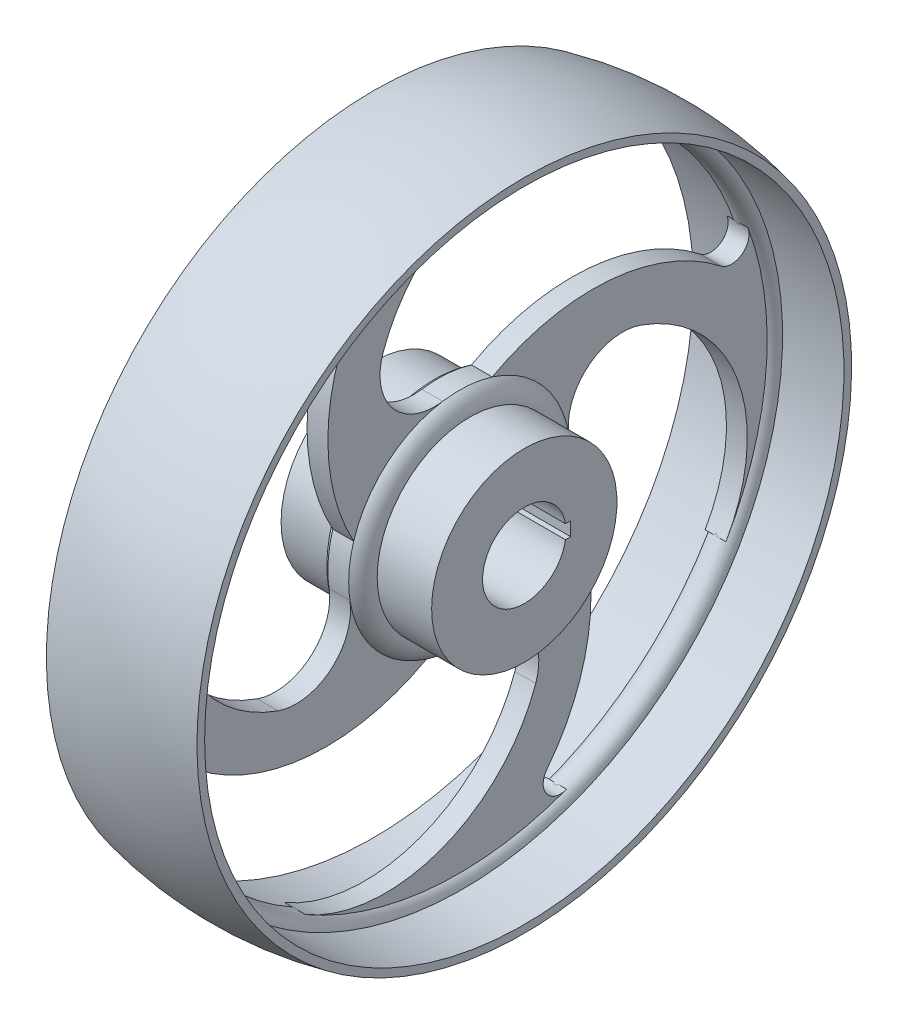
from build123d import *

# Parameters (mm, degrees)
SKETCH7_R               = 132.857142857
BOSS_EXTRUDE2_DEPTH     = 4.5
CUT_EXTRUDE1_DEPTH      = 110
CUT_EXTRUDE1_DEPTH_BACK = 199
SKETCH9_R               = 18.019998537
CUT_EXTRUDE2_DEPTH      = 199
SKETCH10_W              = 4
SKETCH10_H              = 6
CUT_EXTRUDE3_DEPTH      = 199


with BuildPart() as part:
    # Sketch1 → Revolve1 (revolve)
    with BuildSketch(Plane.XY, mode=Mode.PRIVATE) as revolve1_sk:
        with BuildLine():
            Line((-32.5, 40), (-9, 40))
            ThreePointArc((-9, 40), (0, 49), (9, 40))
            Line((9, 40), (32.5, 40))
            Line((32.5, 40), (32.5, 18))
            Line((32.5, 18), (-32.5, 18))
            Line((-32.5, 18), (-32.5, 40))
        make_face()
        with BuildLine():
            Line((-32.5, 138), (-32.5, 141.310827611))
            ThreePointArc((-32.5, 141.310827611), (0, 145), (32.5, 141.310827611))
            Line((32.5, 141.310827611), (32.5, 138))
            Line((32.5, 138), (6, 138))
            ThreePointArc((6, 138), (0, 132.857142857), (-6, 138))
            Line((-6, 138), (-32.5, 138))
        make_face()
    revolve(revolve1_sk.sketch.rotate(Axis((-145, 0, 0), (1, 0, 0)), 90), axis=Axis((-145, 0, 0), (1, 0, 0)))

    # Sketch7 → Boss-Extrude2 (add, symmetric)
    with BuildSketch(Plane(origin=(0, 0, 0), x_dir=(0, 0, -1), z_dir=(1, 0, 0))):
        Circle(SKETCH7_R)
    extrude(amount=BOSS_EXTRUDE2_DEPTH, both=True)

    # Sketch8 → Cut-Extrude1 (cut, two sides: drawn at the far end of the back side and taken through both)
    with BuildSketch(Plane(origin=(0, 0, 0), x_dir=(0, 0, -1), z_dir=(1, 0, 0)).offset(-CUT_EXTRUDE1_DEPTH_BACK)):
        with BuildLine():
            ThreePointArc((14.161396655, 45.648035396), (3.564978673, 47.661087039), (-7.213000003, 47.246808587))
            ThreePointArc((-7.213000003, 47.246808587), (-28.873825323, 55.493585073), (-32.942707777, 78.311228937))
            ThreePointArc((-32.942707777, 78.311228937), (8.117931565, 120.008540996), (66.428571429, 115.057660789))
            ThreePointArc((66.428571429, 115.057660789), (101.49207076, 85.734357063), (124.542219086, 46.262901694))
            ThreePointArc((124.542219086, 46.262901694), (121.94174206, 37.599515508), (112.897549979, 37.738549969))
            ThreePointArc((112.897549979, 37.738549969), (64.715464197, 56.498323737), (14.161396655, 45.648035396))
        make_face()
        with BuildLine():
            ThreePointArc((115.057660789, -66.428571429), (120.008540996, -8.117931565), (78.311228937, 32.942707777))
            ThreePointArc((78.311228937, 32.942707777), (55.493585073, 28.873825323), (47.246808587, 7.213000003))
            ThreePointArc((47.246808587, 7.213000003), (47.661087039, -3.564978673), (45.648035396, -14.161396655))
            ThreePointArc((45.648035396, -14.161396655), (56.498323737, -64.715464197), (37.738549969, -112.897549979))
            ThreePointArc((37.738549969, -112.897549979), (37.599515508, -121.94174206), (46.262901694, -124.542219086))
            ThreePointArc((46.262901694, -124.542219086), (85.734357063, -101.49207076), (115.057660789, -66.428571429))
        make_face()
        with BuildLine():
            ThreePointArc((-66.428571429, -115.057660789), (-8.117931565, -120.008540996), (32.942707777, -78.311228937))
            ThreePointArc((32.942707777, -78.311228937), (28.873825323, -55.493585073), (7.213000003, -47.246808587))
            ThreePointArc((7.213000003, -47.246808587), (-3.564978673, -47.661087039), (-14.161396655, -45.648035396))
            ThreePointArc((-14.161396655, -45.648035396), (-64.715464197, -56.498323737), (-112.897549979, -37.738549969))
            ThreePointArc((-112.897549979, -37.738549969), (-121.94174206, -37.599515508), (-124.542219086, -46.262901694))
            ThreePointArc((-124.542219086, -46.262901694), (-101.49207076, -85.734357063), (-66.428571429, -115.057660789))
        make_face()
        with BuildLine():
            ThreePointArc((-115.057660789, 66.428571429), (-120.008540996, 8.117931565), (-78.311228937, -32.942707777))
            ThreePointArc((-78.311228937, -32.942707777), (-55.493585073, -28.873825323), (-47.246808587, -7.213000003))
            ThreePointArc((-47.246808587, -7.213000003), (-47.661087039, 3.564978673), (-45.648035396, 14.161396655))
            ThreePointArc((-45.648035396, 14.161396655), (-56.498323737, 64.715464197), (-37.738549969, 112.897549979))
            ThreePointArc((-37.738549969, 112.897549979), (-37.599515508, 121.94174206), (-46.262901694, 124.542219086))
            ThreePointArc((-46.262901694, 124.542219086), (-85.734357063, 101.49207076), (-115.057660789, 66.428571429))
        make_face()
    extrude(amount=CUT_EXTRUDE1_DEPTH + CUT_EXTRUDE1_DEPTH_BACK, mode=Mode.SUBTRACT)

    # Sketch9 → Cut-Extrude2 (cut)
    with BuildSketch(Plane(origin=(32.5, 0, 0), x_dir=(0, 0, -1), z_dir=(1, 0, 0))):
        Circle(SKETCH9_R)
    extrude(amount=-CUT_EXTRUDE2_DEPTH, mode=Mode.SUBTRACT)

    # Sketch10 → Cut-Extrude3 (cut)
    with BuildSketch(Plane(origin=(32.5, 0, 0), x_dir=(0, 0, -1), z_dir=(1, 0, 0))):
        with Locations((18.019998537, 0)):
            Rectangle(SKETCH10_W, SKETCH10_H)
    extrude(amount=-CUT_EXTRUDE3_DEPTH, mode=Mode.SUBTRACT)


solid = part.part
